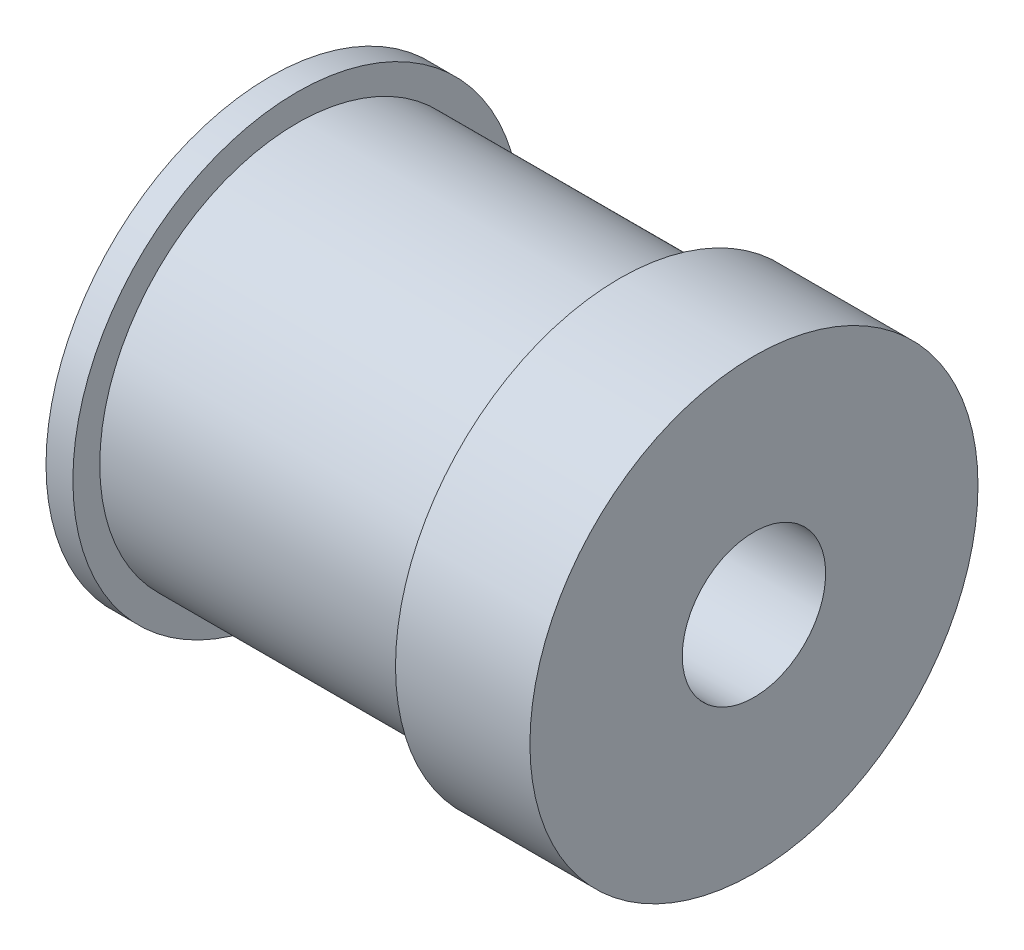
from build123d import *


with BuildPart() as part:
    # Sketch1 → Revolve1 (revolve)
    with BuildSketch(Plane.XY, mode=Mode.PRIVATE) as revolve1_sk:
        Polygon((59.2282167, 12.5), (51.7282167, 12.5), (51.7282167, 11), (33.7282167, 11), (33.7282167, 12.5), (32.2282167, 12.5), (32.2282167, 4.08167039), (32.2282167, 4), (59.2282167, 4), align=None)
    revolve(revolve1_sk.sketch.rotate(Axis((-58.16661515, 0, 0), (1, 0, 0)), 90), axis=Axis((-58.16661515, 0, 0), (1, 0, 0)))


solid = part.part
